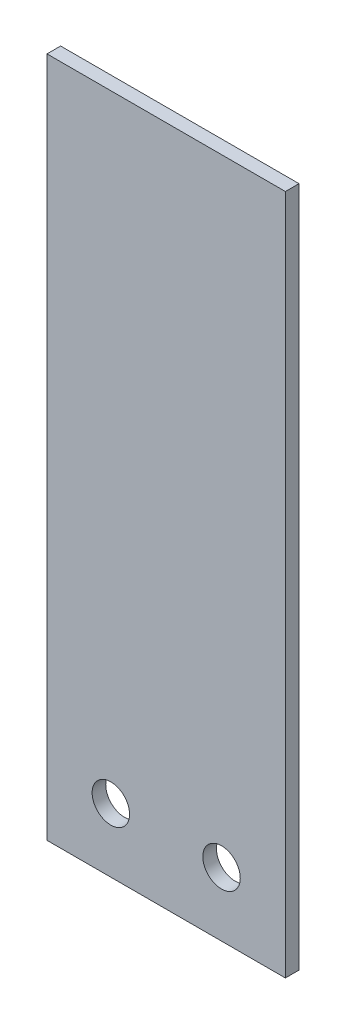
from build123d import *

# Parameters (mm, degrees)
SKETCH1_W           = 28
SKETCH1_H           = 80
BOSS_EXTRUDE1_DEPTH = 1.6
SKETCH2_R           = 2.2
CUT_EXTRUDE1_DEPTH  = 10


with BuildPart() as part:
    # Sketch1 → Boss-Extrude1 (new body)
    with BuildSketch(Plane.XY):
        Rectangle(SKETCH1_W, SKETCH1_H)
    extrude(amount=BOSS_EXTRUDE1_DEPTH)

    # Sketch2 → Cut-Extrude1 (cut)
    with BuildSketch(Plane.XY.offset(1.6)):
        with Locations((6.5, -32.5)):
            Circle(SKETCH2_R)
        with Locations((-6.5, -32.5)):
            Circle(SKETCH2_R)
    extrude(amount=-CUT_EXTRUDE1_DEPTH, mode=Mode.SUBTRACT)


solid = part.part
